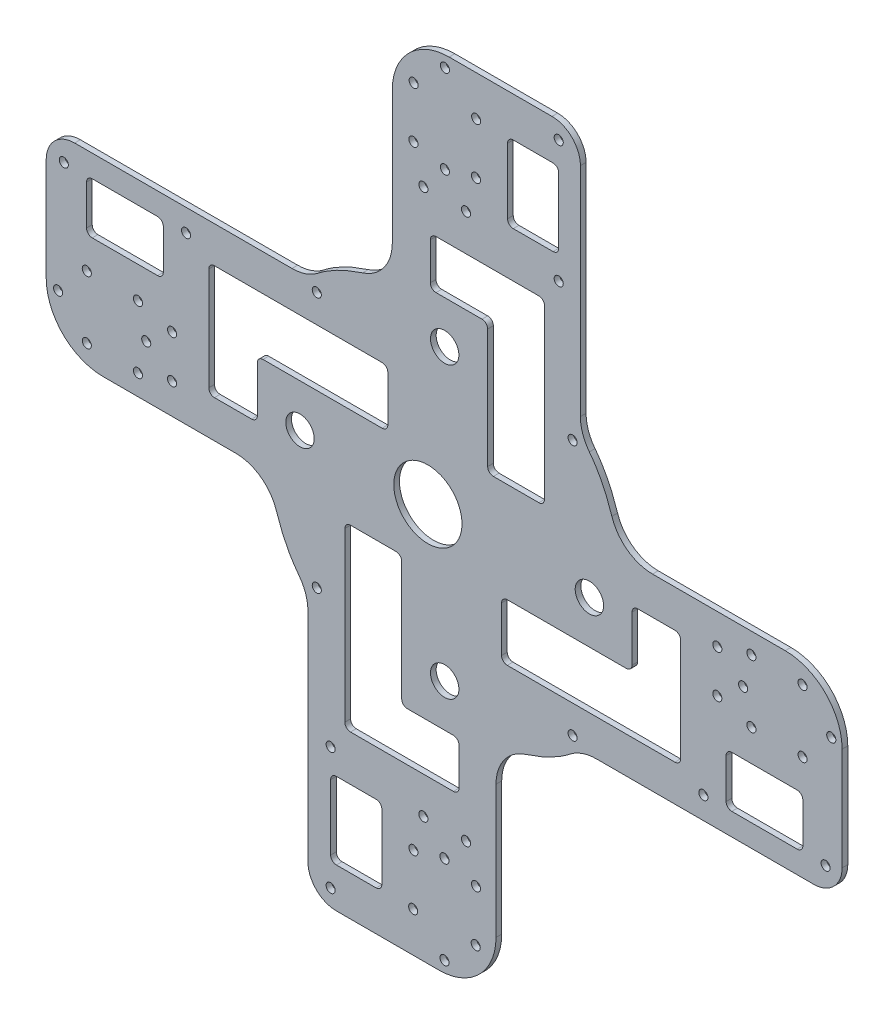
from build123d import *

# Parameters (mm, degrees)
BOSS_EXTRUDE1_DEPTH = 2
SKETCH2_R           = 12
CUT_EXTRUDE1_DEPTH  = 2
SKETCH3_R           = 5
CUT_EXTRUDE2_DEPTH  = 2
SKETCH6_R           = 1.6
CUT_EXTRUDE3_DEPTH  = 2
CUT_EXTRUDE4_DEPTH  = 2
SKETCH8_R           = 1.6
CUT_EXTRUDE5_DEPTH  = 2


with BuildPart() as part:
    # Sketch1 → Boss-Extrude1 (new body)
    with BuildSketch(Plane.XY):
        with BuildLine():
            Line((-67.578586822, -18.244956535), (-114.275273697, -18.244956535))
            ThreePointArc((-114.275273697, -18.244956535), (-128.417409321, -12.387092158), (-134.275273697, 1.755043465))
            Line((-134.275273697, 1.755043465), (-134.275273697, 37.932076816))
            ThreePointArc((-134.275273697, 37.932076816), (-131.346341509, 45.003144627), (-124.275273697, 47.932076816))
            Line((-124.275273697, 47.932076816), (-47.822159271, 47.932076816))
            ThreePointArc((-47.822159271, 47.932076816), (-42.9653732, 48.740120324), (-38.631853057, 51.07719294))
            add(Edge.make_bspline(
                [(-22.970251138, 59.010038822), (-26.707809879, 57.820261463), (-32.221686505, 55.492085886), (-37.016002722, 52.329854673), (-38.631853057, 51.07719294)],
                knots=[0.442587132, 0.442587132, 0.442587132, 0.442587132, 0.471293566, 0.48742036, 0.48742036, 0.48742036, 0.48742036], degree=3))
            ThreePointArc((-22.970251138, 59.010038822), (-15.41135567, 64.450338663), (-12.520230235, 73.303313122))
            Line((-12.520230235, 73.303313122), (-12.520230235, 119.999999997))
            ThreePointArc((-12.520230235, 119.999999997), (-6.662365859, 134.142135621), (7.479769765, 139.999999997))
            Line((7.479769765, 139.999999997), (43.656803115, 139.999999997))
            ThreePointArc((43.656803115, 139.999999997), (50.727870927, 137.071067809), (53.656803115, 129.999999997))
            Line((53.656803115, 129.999999997), (53.656803115, 53.546885571))
            ThreePointArc((53.656803115, 53.546885571), (54.464846624, 48.6900995), (56.80191924, 44.356579357))
            add(Edge.make_bspline(
                [(64.734765122, 28.694977437), (63.544987763, 32.432536179), (61.216812185, 37.946412805), (58.054580973, 42.740729022), (56.80191924, 44.356579357)],
                knots=[0.192587132, 0.192587132, 0.192587132, 0.192587132, 0.221293566, 0.23742036, 0.23742036, 0.23742036, 0.23742036], degree=3))
            ThreePointArc((64.734765122, 28.694977437), (70.175064963, 21.13608197), (79.028039422, 18.244956535))
            Line((79.028039422, 18.244956535), (125.724726296, 18.244956535))
            ThreePointArc((125.724726296, 18.244956535), (139.86686192, 12.387092159), (145.724726296, -1.755043465))
            Line((145.724726296, -1.755043465), (145.724726296, -37.932076816))
            ThreePointArc((145.724726296, -37.932076816), (142.795794108, -45.003144627), (135.724726296, -47.932076816))
            Line((135.724726296, -47.932076816), (59.27161187, -47.932076816))
            ThreePointArc((59.27161187, -47.932076816), (54.4148258, -48.740120324), (50.081305656, -51.07719294))
            add(Edge.make_bspline(
                [(34.419703737, -59.010038822), (38.157262478, -57.820261463), (43.671139105, -55.492085885), (48.465455322, -52.329854673), (50.081305656, -51.07719294)],
                knots=[0.942587132, 0.942587132, 0.942587132, 0.942587132, 0.971293566, 0.98742036, 0.98742036, 0.98742036, 0.98742036], degree=3))
            ThreePointArc((34.419703737, -59.010038822), (26.860808269, -64.450338663), (23.969682834, -73.303313122))
            Line((23.969682834, -73.303313122), (23.969682834, -119.999999997))
            ThreePointArc((23.969682834, -119.999999997), (18.111818458, -134.14213562), (3.969682834, -139.999999997))
            Line((3.969682834, -139.999999997), (-32.207350516, -139.999999997))
            ThreePointArc((-32.207350516, -139.999999997), (-39.278418328, -137.071067809), (-42.207350516, -129.999999997))
            Line((-42.207350516, -129.999999997), (-42.207350516, -53.546885571))
            ThreePointArc((-42.207350516, -53.546885571), (-43.015394024, -48.6900995), (-45.352466641, -44.356579357))
            add(Edge.make_bspline(
                [(-53.285312523, -28.694977437), (-52.887675715, -29.94411108), (-50.872421723, -35.673290561), (-48.089701379, -40.825728566), (-45.352466641, -44.356579357)],
                knots=[0.692587132, 0.692587132, 0.692587132, 0.692587132, 0.702181141, 0.73742036, 0.73742036, 0.73742036, 0.73742036], degree=3))
            ThreePointArc((-53.285312523, -28.694977437), (-58.725612364, -21.13608197), (-67.578586822, -18.244956535))
        make_face()
    extrude(amount=BOSS_EXTRUDE1_DEPTH)

    # Sketch2 → Cut-Extrude1 (cut)
    with BuildSketch(Plane(origin=(0, 0, 0), x_dir=(-1, 0, 0), z_dir=(0, 0, -1))):
        Circle(SKETCH2_R)
    extrude(amount=-CUT_EXTRUDE1_DEPTH, mode=Mode.SUBTRACT)

    # Sketch3 → Cut-Extrude2 (cut)
    with BuildSketch(Plane(origin=(0, 0, 0), x_dir=(-1, 0, 0), z_dir=(0, 0, -1))):
        with Locations((-5.911688245, 50.911688245)):
            Circle(SKETCH3_R)
        with Locations((45, 0)):
            Circle(SKETCH3_R)
        with Locations((-5.911688245, -50.911688245)):
            Circle(SKETCH3_R)
        with Locations((-56.823376491, 0)):
            Circle(SKETCH3_R)
    extrude(amount=-CUT_EXTRUDE2_DEPTH, mode=Mode.SUBTRACT)

    # Sketch6 → Cut-Extrude3 (cut)
    with BuildSketch(Plane(origin=(0, 0, 0), x_dir=(-1, 0, 0), z_dir=(0, 0, -1))):
        with Locations((34.207350516, -133.999999997)):
            Circle(SKETCH6_R)
        with Locations((34.207350516, -90.999999997)):
            Circle(SKETCH6_R)
        with Locations((5.169507628, -125.911688249)):
            Circle(SKETCH6_R)
        with Locations((5.088404112, -107.911688248)):
            Circle(SKETCH6_R)
        with Locations((-16.83058473, -125.911688249)):
            Circle(SKETCH6_R)
        with Locations((-16.911688245, -107.911688248)):
            Circle(SKETCH6_R)
        with Locations((-13.411688245, -95.911688245)):
            Circle(SKETCH6_R)
        with Locations((1.588311755, -95.911688245)):
            Circle(SKETCH6_R)
        with Locations((39.088311755, -45)):
            Circle(SKETCH6_R)
        with Locations((-50.911688245, -45)):
            Circle(SKETCH6_R)
        with Locations((-50.911688245, 45)):
            Circle(SKETCH6_R)
        with Locations((39.088311755, 45)):
            Circle(SKETCH6_R)
        with Locations((-139.911688242, -40.119038761)):
            Circle(SKETCH6_R)
        with Locations((-96.911688242, -40.119038761)):
            Circle(SKETCH6_R)
        with Locations((-131.823376494, -11.081195873)):
            Circle(SKETCH6_R)
        with Locations((-113.823376493, -11.000092357)):
            Circle(SKETCH6_R)
        with Locations((-131.823376494, 10.918896485)):
            Circle(SKETCH6_R)
        with Locations((-113.823376493, 11.000000001)):
            Circle(SKETCH6_R)
        with Locations((-101.82337649, 7.500000001)):
            Circle(SKETCH6_R)
        with Locations((-101.82337649, -7.499999999)):
            Circle(SKETCH6_R)
        with Locations((-46.030727006, 133.999999997)):
            Circle(SKETCH6_R)
        with Locations((-46.030727006, 90.999999997)):
            Circle(SKETCH6_R)
        with Locations((-16.992884118, 125.911688249)):
            Circle(SKETCH6_R)
        with Locations((-16.911780602, 107.911688248)):
            Circle(SKETCH6_R)
        with Locations((5.00720824, 125.911688249)):
            Circle(SKETCH6_R)
        with Locations((5.088311756, 107.911688248)):
            Circle(SKETCH6_R)
        with Locations((1.588311756, 95.911688245)):
            Circle(SKETCH6_R)
        with Locations((-13.411688244, 95.911688245)):
            Circle(SKETCH6_R)
        with Locations((128.088311752, 40.119038761)):
            Circle(SKETCH6_R)
        with Locations((85.088311752, 40.119038761)):
            Circle(SKETCH6_R)
        with Locations((120.000000004, 11.081195873)):
            Circle(SKETCH6_R)
        with Locations((102.000000003, 11.000092357)):
            Circle(SKETCH6_R)
        with Locations((120.000000004, -10.918896485)):
            Circle(SKETCH6_R)
        with Locations((102.000000003, -11.000000001)):
            Circle(SKETCH6_R)
        with Locations((90.000000001, -7.500000001)):
            Circle(SKETCH6_R)
        with Locations((90.000000001, 7.499999999)):
            Circle(SKETCH6_R)
    extrude(amount=-CUT_EXTRUDE3_DEPTH, mode=Mode.SUBTRACT)

    # Sketch7 → Cut-Extrude4 (cut)
    with BuildSketch(Plane.XY.offset(2)):
        with BuildLine():
            Line((-29.207350516, -65.911688245), (-29.207350516, -80.999999997))
            ThreePointArc((-29.207350516, -80.999999997), (-28.621564078, -82.414213559), (-27.207350516, -82.999999997))
            Line((-27.207350516, -82.999999997), (8.969682834, -82.999999997))
            ThreePointArc((8.969682834, -82.999999997), (10.383896397, -82.414213559), (10.969682834, -80.999999997))
            Line((10.969682834, -80.999999997), (10.969682834, -67.911688245))
            ThreePointArc((10.969682834, -67.911688245), (10.383896397, -66.497474683), (8.969682834, -65.911688245))
            Line((8.969682834, -65.911688245), (-7.207350516, -65.911688245))
            ThreePointArc((-7.207350516, -65.911688245), (-8.621564078, -65.325901808), (-9.207350516, -63.911688245))
            Line((-9.207350516, -63.911688245), (-9.207350516, -22))
            ThreePointArc((-9.207350516, -22), (-9.793136954, -20.585786438), (-11.207350516, -20))
            Line((-11.207350516, -20), (-27.207350516, -20))
            ThreePointArc((-27.207350516, -20), (-28.621564078, -20.585786438), (-29.207350516, -22))
            Line((-29.207350516, -22), (-29.207350516, -65.911688245))
        make_face()
        with BuildLine():
            Line((-32.207350516, -98.999999997), (-18.207350516, -98.999999997))
            ThreePointArc((-18.207350516, -98.999999997), (-16.793136954, -99.585786434), (-16.207350516, -100.999999997))
            Line((-16.207350516, -100.999999997), (-16.207350516, -123.999999997))
            ThreePointArc((-16.207350516, -123.999999997), (-16.793136954, -125.414213559), (-18.207350516, -125.999999997))
            Line((-18.207350516, -125.999999997), (-32.207350516, -125.999999997))
            ThreePointArc((-32.207350516, -125.999999997), (-33.621564078, -125.414213559), (-34.207350516, -123.999999997))
            Line((-34.207350516, -123.999999997), (-34.207350516, -100.999999997))
            ThreePointArc((-34.207350516, -100.999999997), (-33.621564078, -99.585786434), (-32.207350516, -98.999999997))
        make_face()
        with BuildLine():
            Line((-60, 35.119038761), (-75.088311751, 35.119038761))
            ThreePointArc((-75.088311751, 35.119038761), (-76.502525314, 34.533252324), (-77.088311751, 33.119038761))
            Line((-77.088311751, 33.119038761), (-77.088311751, -3.057994589))
            ThreePointArc((-77.088311751, -3.057994589), (-76.502525314, -4.472208151), (-75.088311751, -5.057994589))
            Line((-75.088311751, -5.057994589), (-62, -5.057994589))
            ThreePointArc((-62, -5.057994589), (-60.585786438, -4.472208151), (-60, -3.057994589))
            Line((-60, -3.057994589), (-60, 13.119038761))
            ThreePointArc((-60, 13.119038761), (-59.414213562, 14.533252324), (-58, 15.119038761))
            Line((-58, 15.119038761), (-16.088311755, 15.119038761))
            ThreePointArc((-16.088311755, 15.119038761), (-14.674098192, 15.704825199), (-14.088311755, 17.119038761))
            Line((-14.088311755, 17.119038761), (-14.088311755, 33.119038761))
            ThreePointArc((-14.088311755, 33.119038761), (-14.674098192, 34.533252324), (-16.088311755, 35.119038761))
            Line((-16.088311755, 35.119038761), (-60, 35.119038761))
        make_face()
        with BuildLine():
            Line((41.030727007, 65.911688245), (41.030727007, 80.999999997))
            ThreePointArc((41.030727007, 80.999999997), (40.444940569, 82.414213559), (39.030727007, 82.999999997))
            Line((39.030727007, 82.999999997), (2.853693656, 82.999999997))
            ThreePointArc((2.853693656, 82.999999997), (1.439480094, 82.414213559), (0.853693656, 80.999999997))
            Line((0.853693656, 80.999999997), (0.853693656, 67.911688245))
            ThreePointArc((0.853693656, 67.911688245), (1.439480094, 66.497474683), (2.853693656, 65.911688245))
            Line((2.853693656, 65.911688245), (19.030727007, 65.911688245))
            ThreePointArc((19.030727007, 65.911688245), (20.444940569, 65.325901808), (21.030727007, 63.911688245))
            Line((21.030727007, 63.911688245), (21.030727007, 22))
            ThreePointArc((21.030727007, 22), (21.616513444, 20.585786438), (23.030727007, 20))
            Line((23.030727007, 20), (39.030727007, 20))
            ThreePointArc((39.030727007, 20), (40.444940569, 20.585786438), (41.030727007, 22))
            Line((41.030727007, 22), (41.030727007, 65.911688245))
        make_face()
        with BuildLine():
            Line((71.823376491, -35.119038761), (86.911688242, -35.119038761))
            ThreePointArc((86.911688242, -35.119038761), (88.325901805, -34.533252324), (88.911688242, -33.119038761))
            Line((88.911688242, -33.119038761), (88.911688242, 3.057994589))
            ThreePointArc((88.911688242, 3.057994589), (88.325901805, 4.472208151), (86.911688242, 5.057994589))
            Line((86.911688242, 5.057994589), (73.823376491, 5.057994589))
            ThreePointArc((73.823376491, 5.057994589), (72.409162928, 4.472208151), (71.823376491, 3.057994589))
            Line((71.823376491, 3.057994589), (71.823376491, -13.119038761))
            ThreePointArc((71.823376491, -13.119038761), (71.237590053, -14.533252324), (69.823376491, -15.119038761))
            Line((69.823376491, -15.119038761), (27.911688245, -15.119038761))
            ThreePointArc((27.911688245, -15.119038761), (26.497474683, -15.704825199), (25.911688245, -17.119038761))
            Line((25.911688245, -17.119038761), (25.911688245, -33.119038761))
            ThreePointArc((25.911688245, -33.119038761), (26.497474683, -34.533252324), (27.911688245, -35.119038761))
            Line((27.911688245, -35.119038761), (71.823376491, -35.119038761))
        make_face()
        with BuildLine():
            Line((-93.088311751, 38.119038761), (-93.088311751, 24.119038761))
            ThreePointArc((-93.088311751, 24.119038761), (-93.674098189, 22.704825199), (-95.088311751, 22.119038761))
            Line((-95.088311751, 22.119038761), (-118.088311751, 22.119038761))
            ThreePointArc((-118.088311751, 22.119038761), (-119.502525314, 22.704825199), (-120.088311751, 24.119038761))
            Line((-120.088311751, 24.119038761), (-120.088311751, 38.119038761))
            ThreePointArc((-120.088311751, 38.119038761), (-119.502525314, 39.533252324), (-118.088311751, 40.119038761))
            Line((-118.088311751, 40.119038761), (-95.088311751, 40.119038761))
            ThreePointArc((-95.088311751, 40.119038761), (-93.674098189, 39.533252324), (-93.088311751, 38.119038761))
        make_face()
        with BuildLine():
            Line((44.030727007, 98.999999997), (30.030727007, 98.999999997))
            ThreePointArc((30.030727007, 98.999999997), (28.616513444, 99.585786434), (28.030727007, 100.999999997))
            Line((28.030727007, 100.999999997), (28.030727007, 123.999999997))
            ThreePointArc((28.030727007, 123.999999997), (28.616513444, 125.414213559), (30.030727007, 125.999999997))
            Line((30.030727007, 125.999999997), (44.030727007, 125.999999997))
            ThreePointArc((44.030727007, 125.999999997), (45.444940569, 125.414213559), (46.030727007, 123.999999997))
            Line((46.030727007, 123.999999997), (46.030727007, 100.999999997))
            ThreePointArc((46.030727007, 100.999999997), (45.444940569, 99.585786434), (44.030727007, 98.999999997))
        make_face()
        with BuildLine():
            Line((104.911688242, -38.119038761), (104.911688242, -24.119038761))
            ThreePointArc((104.911688242, -24.119038761), (105.49747468, -22.704825199), (106.911688242, -22.119038761))
            Line((106.911688242, -22.119038761), (129.911688242, -22.119038761))
            ThreePointArc((129.911688242, -22.119038761), (131.325901805, -22.704825199), (131.911688242, -24.119038761))
            Line((131.911688242, -24.119038761), (131.911688242, -38.119038761))
            ThreePointArc((131.911688242, -38.119038761), (131.325901805, -39.533252324), (129.911688242, -40.119038761))
            Line((129.911688242, -40.119038761), (106.911688242, -40.119038761))
            ThreePointArc((106.911688242, -40.119038761), (105.49747468, -39.533252324), (104.911688242, -38.119038761))
        make_face()
    extrude(amount=-CUT_EXTRUDE4_DEPTH, mode=Mode.SUBTRACT)

    # Sketch8 → Cut-Extrude5 (cut)
    with BuildSketch(Plane.XY.offset(2)):
        with Locations((5.830538551, -104.999999997)):
            Circle(SKETCH8_R)
        with Locations((5.830538551, -135.999999997)):
            Circle(SKETCH8_R)
        with Locations((-99.088311751, 0.081149694)):
            Circle(SKETCH8_R)
        with Locations((-130.088311751, 0.081149694)):
            Circle(SKETCH8_R)
        with Locations((5.99283794, 104.999999997)):
            Circle(SKETCH8_R)
        with Locations((5.99283794, 135.999999997)):
            Circle(SKETCH8_R)
        with Locations((110.911688242, -0.081149694)):
            Circle(SKETCH8_R)
        with Locations((141.911688242, -0.081149694)):
            Circle(SKETCH8_R)
    extrude(amount=-CUT_EXTRUDE5_DEPTH, mode=Mode.SUBTRACT)


solid = part.part
